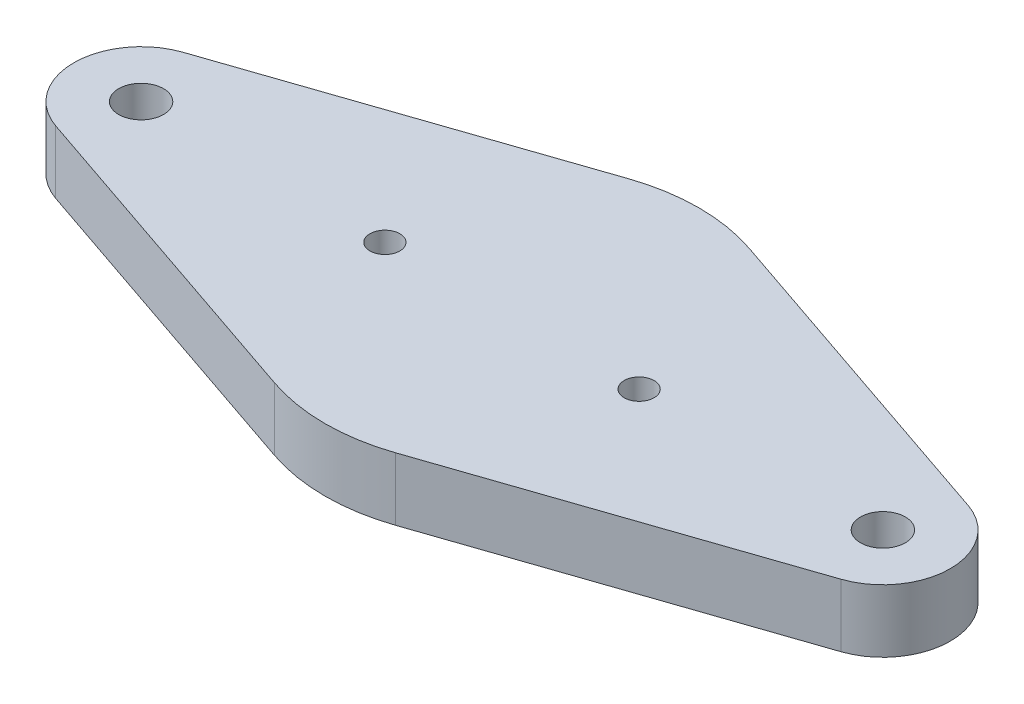
from build123d import *

# Parameters (mm, degrees)
CROQUIS1_R              = 1.5
CROQUIS1_R_2            = 1
SALIENTE_EXTRUIR1_DEPTH = 4.2


with BuildPart() as part:
    # Croquis1 → Saliente-Extruir1 (new body)
    with BuildSketch(Plane(origin=(0, 0, 0), x_dir=(1, 0, 0), z_dir=(0, 1, 0))):
        with BuildLine():
            Line((26.251612903, 4.259438928), (4.032258065, 11.831774799))
            ThreePointArc((4.032258065, 11.831774799), (0, 12.5), (-4.032258065, 11.831774799))
            Line((-4.032258065, 11.831774799), (-26.251612903, 4.259438928))
            ThreePointArc((-26.251612903, 4.259438928), (-29.3, 0), (-26.251612903, -4.259438928))
            Line((-26.251612903, -4.259438928), (-4.032258065, -11.831774799))
            ThreePointArc((-4.032258065, -11.831774799), (0, -12.5), (4.032258065, -11.831774799))
            Line((4.032258065, -11.831774799), (26.251612903, -4.259438928))
            ThreePointArc((26.251612903, -4.259438928), (29.3, 0), (26.251612903, 4.259438928))
        make_face()
        with Locations(Location((24.8, 0, 0), (0, 0, 270))):
            Circle(CROQUIS1_R, mode=Mode.SUBTRACT)
        with Locations(Location((-24.8, 0, 0), (0, 0, 270))):
            Circle(CROQUIS1_R, mode=Mode.SUBTRACT)
        with Locations(Location((8.5, 0, 0), (0, 0, 270))):
            Circle(CROQUIS1_R_2, mode=Mode.SUBTRACT)
        with Locations(Location((-8.5, 0, 0), (0, 0, 270))):
            Circle(CROQUIS1_R_2, mode=Mode.SUBTRACT)
    extrude(amount=SALIENTE_EXTRUIR1_DEPTH)


solid = part.part
